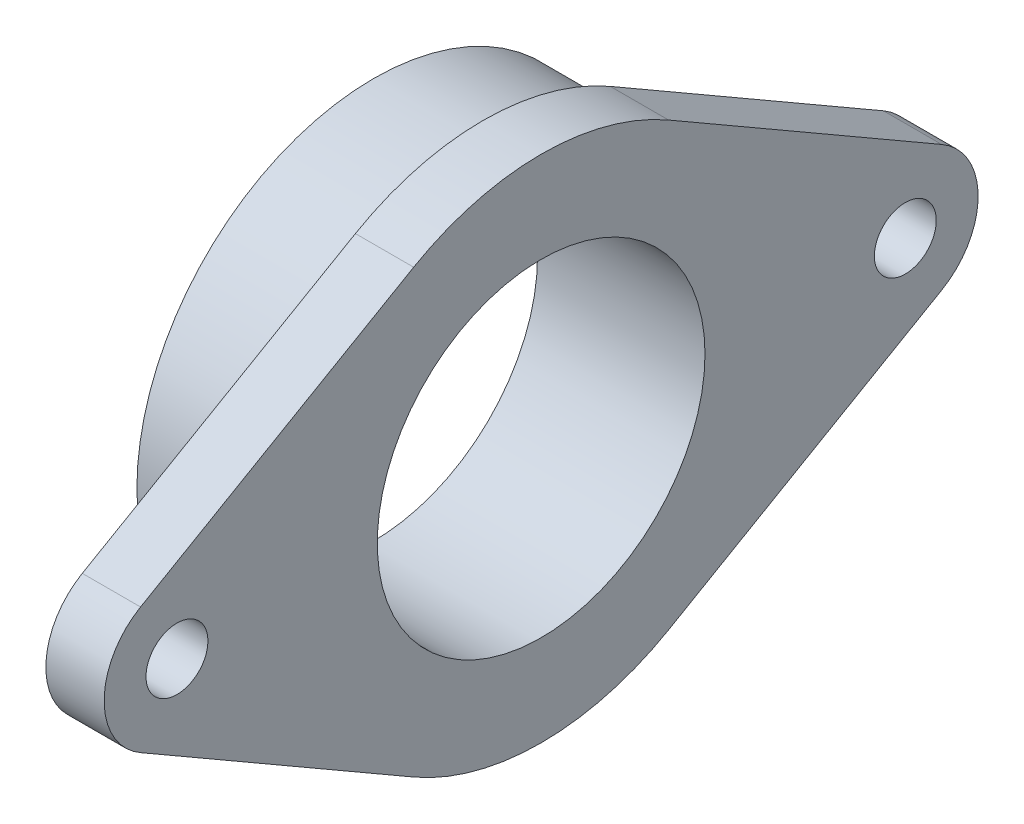
from build123d import *

# Parameters (mm, degrees)
SKETCH1_R           = 32.5
SKETCH1_R_2         = 22.5
BOSS_EXTRUDE1_DEPTH = 15
SKETCH2_R           = 22.5
SKETCH2_R_2         = 4.25
BOSS_EXTRUDE2_DEPTH = 8


with BuildPart() as part:
    # Sketch1 → Boss-Extrude1 (new body)
    with BuildSketch(Plane(origin=(0, 0, 0), x_dir=(0, 0, -1), z_dir=(1, 0, 0))):
        Circle(SKETCH1_R)
        Circle(SKETCH1_R_2, mode=Mode.SUBTRACT)
    extrude(amount=BOSS_EXTRUDE1_DEPTH)

    # Sketch2 → Boss-Extrude2 (add)
    with BuildSketch(Plane(origin=(15, 0, 0), x_dir=(0, 0, -1), z_dir=(1, 0, 0))):
        with BuildLine():
            Line((-55, 8.660254038), (-17.5, 30.310889132))
            ThreePointArc((-17.5, 30.310889132), (0, 35), (17.5, 30.310889132))
            Line((17.5, 30.310889132), (55, 8.660254038))
            ThreePointArc((55, 8.660254038), (60, 0), (55, -8.660254038))
            Line((55, -8.660254038), (17.5, -30.310889132))
            ThreePointArc((17.5, -30.310889132), (0, -35), (-17.5, -30.310889132))
            Line((-17.5, -30.310889132), (-55, -8.660254038))
            ThreePointArc((-55, -8.660254038), (-60, 0), (-55, 8.660254038))
        make_face()
        Circle(SKETCH2_R, mode=Mode.SUBTRACT)
        with Locations((-50, 0)):
            Circle(SKETCH2_R_2, mode=Mode.SUBTRACT)
        with Locations((50, 0)):
            Circle(SKETCH2_R_2, mode=Mode.SUBTRACT)
    extrude(amount=BOSS_EXTRUDE2_DEPTH)


solid = part.part
